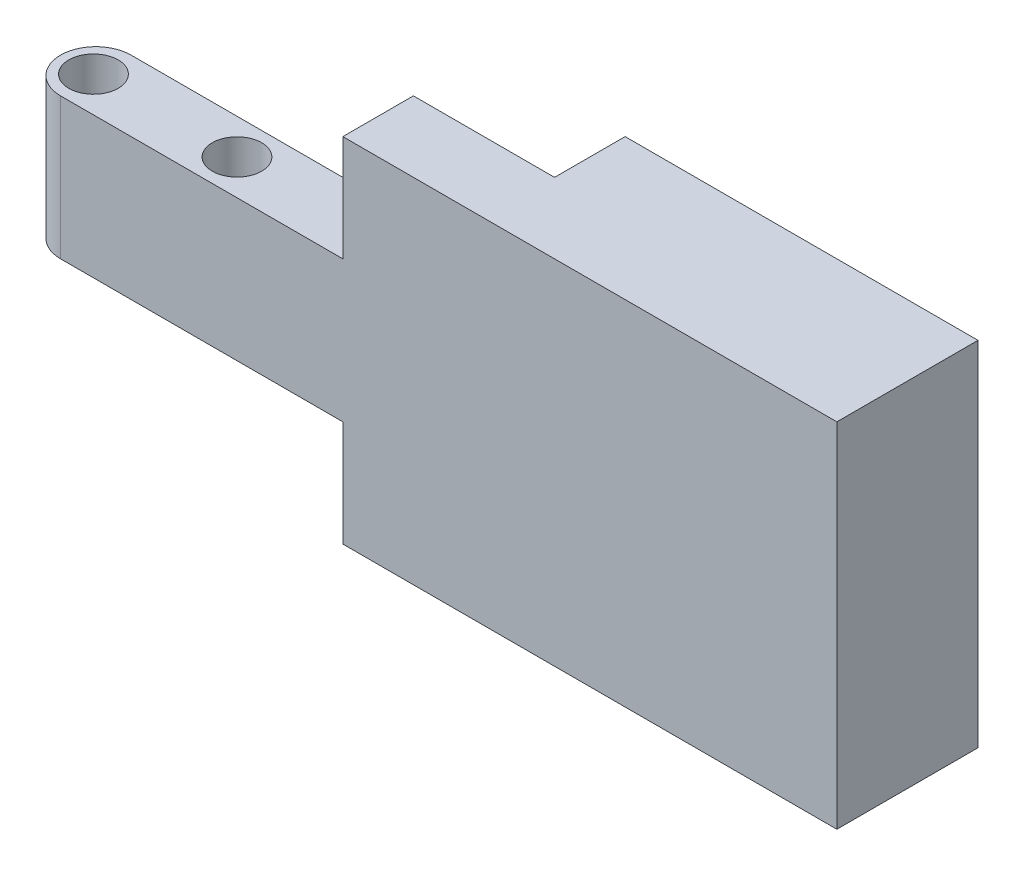
from build123d import *

# Parameters (mm, degrees)
BOSS_EXTRUDE1_DEPTH      = 25
BOSS_EXTRUDE1_DEPTH_BACK = 25
SKETCH1_W                = 70
SKETCH1_H                = 10
BOSS_EXTRUDE2_DEPTH      = 10
BOSS_EXTRUDE2_DEPTH_BACK = 10
CUT_EXTRUDE1_DEPTH       = 19
CUT_EXTRUDE1_DEPTH_BACK  = 16
SKETCH3_R                = 3.5
SKETCH4_W                = 50
SKETCH4_H                = 50
BOSS_EXTRUDE3_DEPTH      = 15


with BuildPart() as part:
    # Sketch1 → Boss-Extrude1 (new, two sides: drawn at the far end of the back side and taken through both)
    with BuildSketch(Plane(origin=(0, 0, 0), x_dir=(1, 0, 0), z_dir=(0, 1, 0)).offset(-BOSS_EXTRUDE1_DEPTH_BACK)):
        Rectangle(SKETCH1_W, SKETCH1_H)
    extrude(amount=BOSS_EXTRUDE1_DEPTH + BOSS_EXTRUDE1_DEPTH_BACK)

    # Sketch2 → Boss-Extrude2 (add, two sides: drawn at the far end of the back side and taken through both)
    with BuildSketch(Plane(origin=(0, 0, 0), x_dir=(1, 0, 0), z_dir=(0, 1, 0)).offset(-BOSS_EXTRUDE2_DEPTH_BACK)):
        with BuildLine():
            Line((-75, 5), (-35, 5))
            Line((-35, 5), (-35, -5))
            Line((-35, -5), (-75, -5))
            ThreePointArc((-75, -5), (-80, 0), (-75, 5))
        make_face()
    extrude(amount=BOSS_EXTRUDE2_DEPTH + BOSS_EXTRUDE2_DEPTH_BACK)

    # Sketch3 → Cut-Extrude1 (cut, two sides: drawn at the far end of the back side and taken through both)
    with BuildSketch(Plane(origin=(0, 0, 0), x_dir=(1, 0, 0), z_dir=(0, 1, 0)).offset(-CUT_EXTRUDE1_DEPTH_BACK)):
        with Locations((-75.333177097, 0)):
            Circle(SKETCH3_R)
        with Locations((-55, 0)):
            Circle(SKETCH3_R)
    extrude(amount=CUT_EXTRUDE1_DEPTH + CUT_EXTRUDE1_DEPTH_BACK, mode=Mode.SUBTRACT)

    # Sketch4 → Boss-Extrude3 (add)
    with BuildSketch(Plane.XY):
        with Locations((10, 0)):
            Rectangle(SKETCH4_W, SKETCH4_H)
    extrude(amount=-BOSS_EXTRUDE3_DEPTH)


solid = part.part
